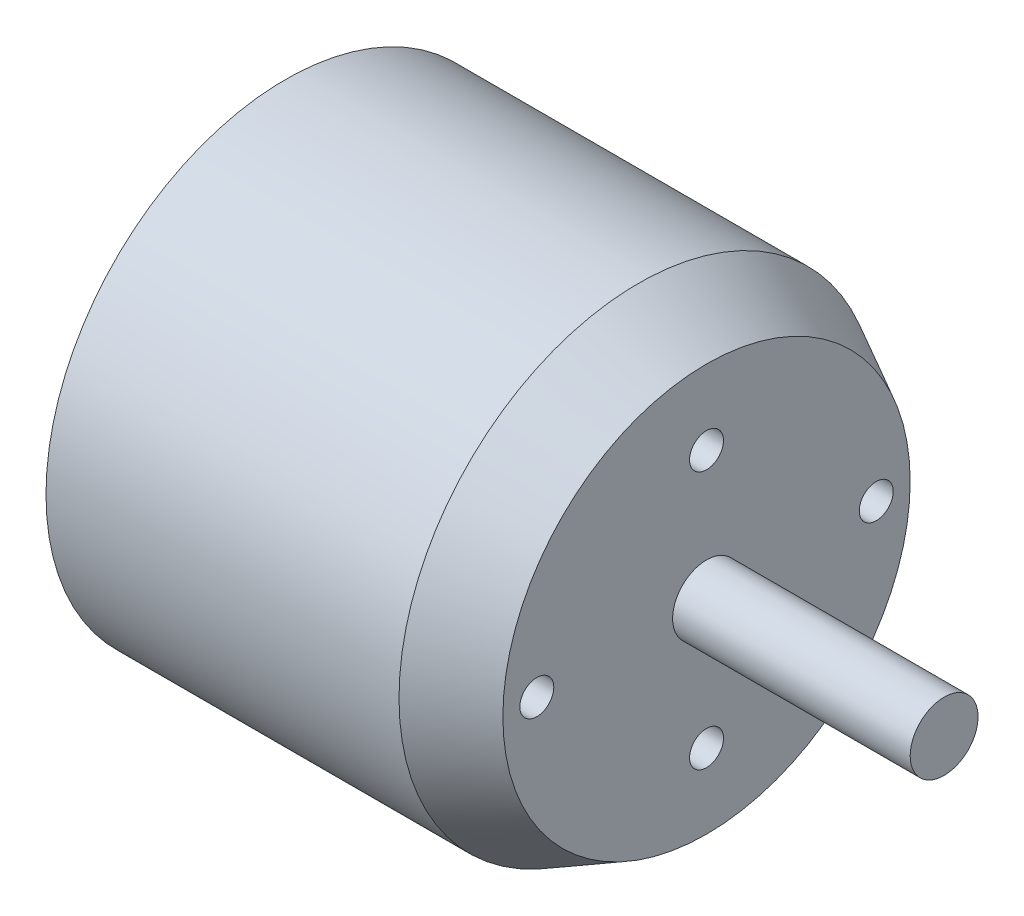
from build123d import *

# Parameters (mm, degrees)
SKETCH1_3_W               = 17.5
SKETCH1_3_H               = 2.5
SKETCH1_3_W_2             = 2
M3X0_5_TAPPED_HOLE1_D     = 2.5
M3X0_5_TAPPED_HOLE1_DEPTH = 7.5
M3X0_5_TAPPED_HOLE1_TIP   = 0.751075774


with BuildPart() as part:
    # Sketch1 → Revolve1 (revolve)
    with BuildSketch(Plane.XY):
        Polygon((-34, 0), (0, 0), (0, 2.5), (0, 15), (-5, 17.65), (-31, 17.65), (-34, 9), (-34, 2.5), align=None)
    revolve(axis=Axis((1.227272727, 0, 0), (1, 0, 0)))

    # Sketch1<3> → Revolve2 (revolve)
    with BuildSketch(Plane.XY):
        with Locations((8.75, 1.25)):
            Rectangle(SKETCH1_3_W, SKETCH1_3_H)
        with Locations((-35, 1.25)):
            Rectangle(SKETCH1_3_W_2, SKETCH1_3_H)
    revolve(axis=Axis((1.227272727, 0, 0), (1, 0, 0)))

    # M3x0.5 Tapped Hole1
    with Locations(Plane(origin=(0, 0, 0), x_dir=(0, 0, -1), z_dir=(1, 0, 0))):
        with Locations((0, 9.5), (0, -9.5), (-12.5, 0), (12.5, 0)):
            Hole(M3X0_5_TAPPED_HOLE1_D / 2, depth=M3X0_5_TAPPED_HOLE1_DEPTH)
            with Locations((0, 0, -(M3X0_5_TAPPED_HOLE1_DEPTH + M3X0_5_TAPPED_HOLE1_TIP / 2))):  # 118° drill point
                Cone(0, M3X0_5_TAPPED_HOLE1_D / 2, M3X0_5_TAPPED_HOLE1_TIP, mode=Mode.SUBTRACT)


solid = part.part
